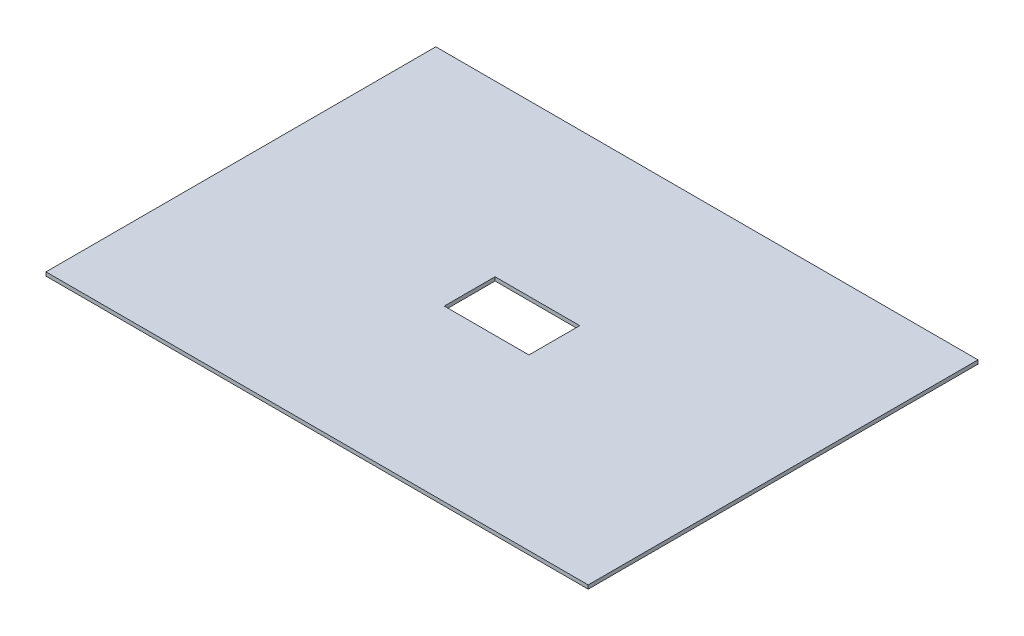
from build123d import *

# Parameters (mm, degrees)
SKETCH_1_W          = 320.2
SKETCH_1_H          = 230.2
EXTRUDE_1_DEPTH     = 2.2
SKETCH_2_W          = 50
SKETCH_2_H          = 30
CUT_EXTRUDE_1_DEPTH = 395.366479306


with BuildPart() as part:
    # 草图1 → 凸台-拉伸1 (new body)
    with BuildSketch(Plane(origin=(0, 0, 0), x_dir=(1, 0, 0), z_dir=(0, 1, 0))):
        with Locations((160.1, -115.1)):
            Rectangle(SKETCH_1_W, SKETCH_1_H)
    extrude(amount=EXTRUDE_1_DEPTH)

    # 草图2 → 切除-拉伸1 (cut, through all)
    with BuildSketch(Plane(origin=(0, 2.2, 0), x_dir=(1, 0, 0), z_dir=(0, 1, 0))):
        with Locations((160.1, -115.1)):
            Rectangle(SKETCH_2_W, SKETCH_2_H)
    extrude(amount=-CUT_EXTRUDE_1_DEPTH, mode=Mode.SUBTRACT)


solid = part.part
